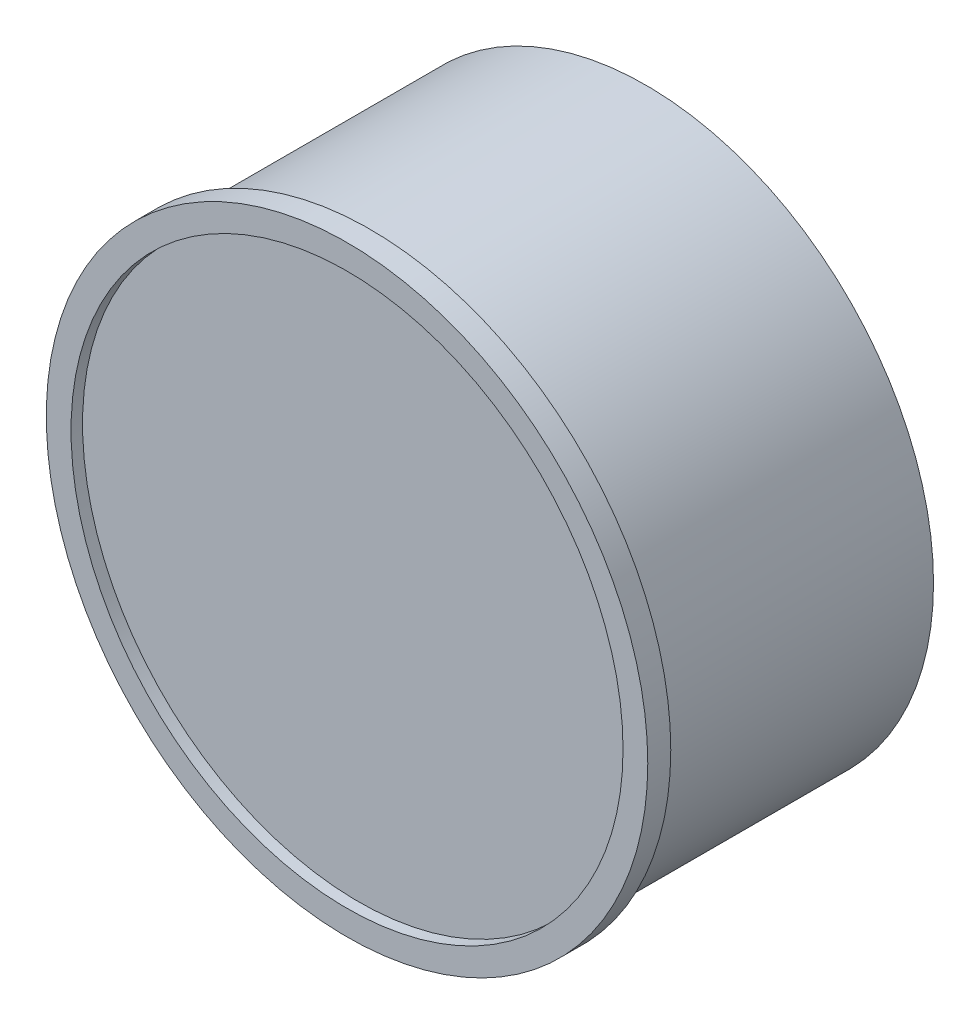
from build123d import *

# Parameters (mm, degrees)
SKETCH1_R           = 41.5163
BOSS_EXTRUDE1_DEPTH = 3.175
SKETCH2_R           = 39.6875
BOSS_EXTRUDE2_DEPTH = 38.1
SKETCH3_R           = 38.1
CUT_EXTRUDE1_DEPTH  = 1.5875


with BuildPart() as part:
    # Sketch1 → Boss-Extrude1 (new body)
    with BuildSketch(Plane.XY):
        Circle(SKETCH1_R)
    extrude(amount=BOSS_EXTRUDE1_DEPTH)

    # Sketch2 → Boss-Extrude2 (add)
    with BuildSketch(Plane(origin=(0, 0, 0), x_dir=(-1, 0, 0), z_dir=(0, 0, -1))):
        Circle(SKETCH2_R)
    extrude(amount=BOSS_EXTRUDE2_DEPTH)

    # Sketch3 → Cut-Extrude1 (cut)
    with BuildSketch(Plane.XY.offset(3.175)):
        Circle(SKETCH3_R)
    extrude(amount=-CUT_EXTRUDE1_DEPTH, mode=Mode.SUBTRACT)


solid = part.part
